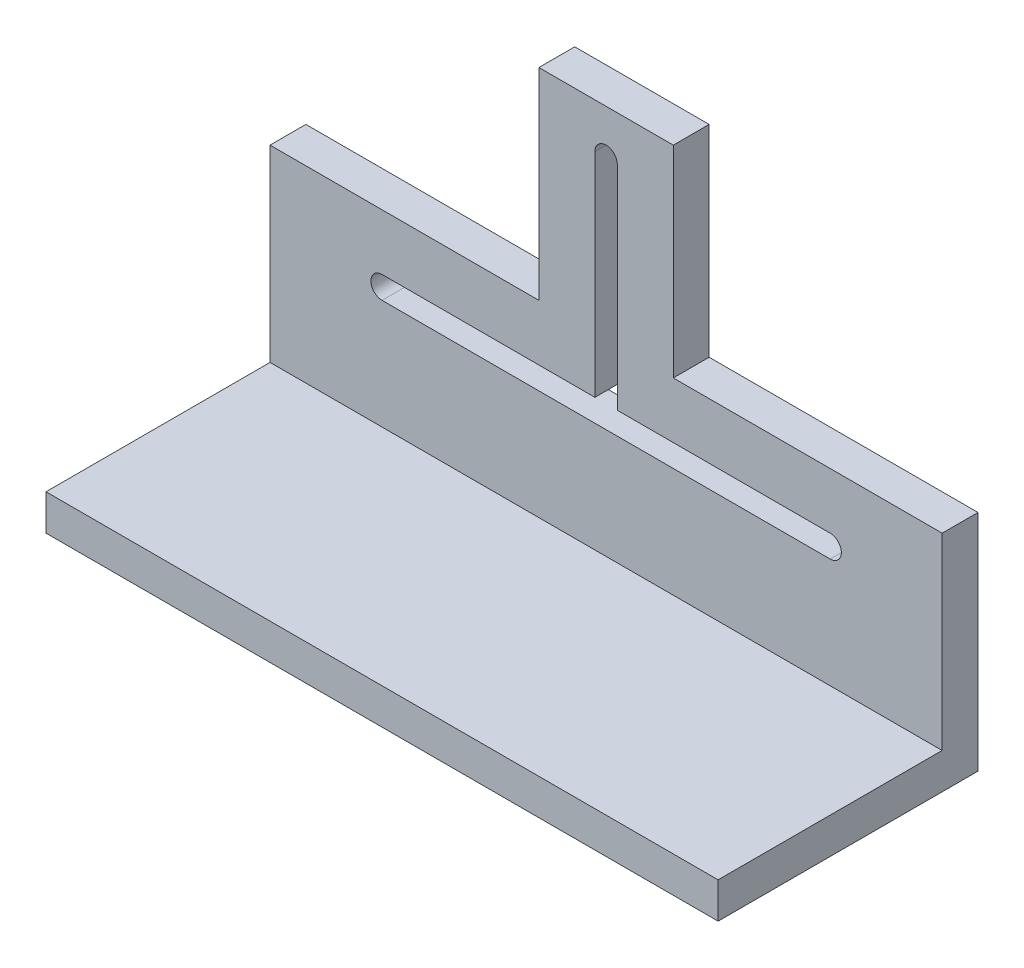
from build123d import *

# Parameters (mm, degrees)
BOSS_EXTRUDE1_DEPTH = 8
SKETCH2_W           = 150
SKETCH2_H           = 8
BOSS_EXTRUDE2_DEPTH = 50


with BuildPart() as part:
    # Sketch1 → Boss-Extrude1 (new body)
    with BuildSketch(Plane.XY):
        Polygon((-15, 15), (-15, 60), (15, 60), (15, 15), (75, 15), (75, -35), (-75, -35), (-75, 15), align=None)
        with BuildLine():
            Line((-2.5, 2.5), (-50, 2.5))
            ThreePointArc((-50, 2.5), (-52.5, 0), (-50, -2.5))
            Line((-50, -2.5), (50, -2.5))
            ThreePointArc((50, -2.5), (52.5, 0), (50, 2.5))
            Line((50, 2.5), (2.5, 2.5))
            Line((2.5, 2.5), (2.5, 50))
            ThreePointArc((2.5, 50), (0, 52.5), (-2.5, 50))
            Line((-2.5, 50), (-2.5, 2.5))
        make_face(mode=Mode.SUBTRACT)
    extrude(amount=-BOSS_EXTRUDE1_DEPTH)

    # Sketch2 → Boss-Extrude2 (add)
    with BuildSketch(Plane.XY):
        with Locations((0, -31)):
            Rectangle(SKETCH2_W, SKETCH2_H)
    extrude(amount=BOSS_EXTRUDE2_DEPTH)


solid = part.part
